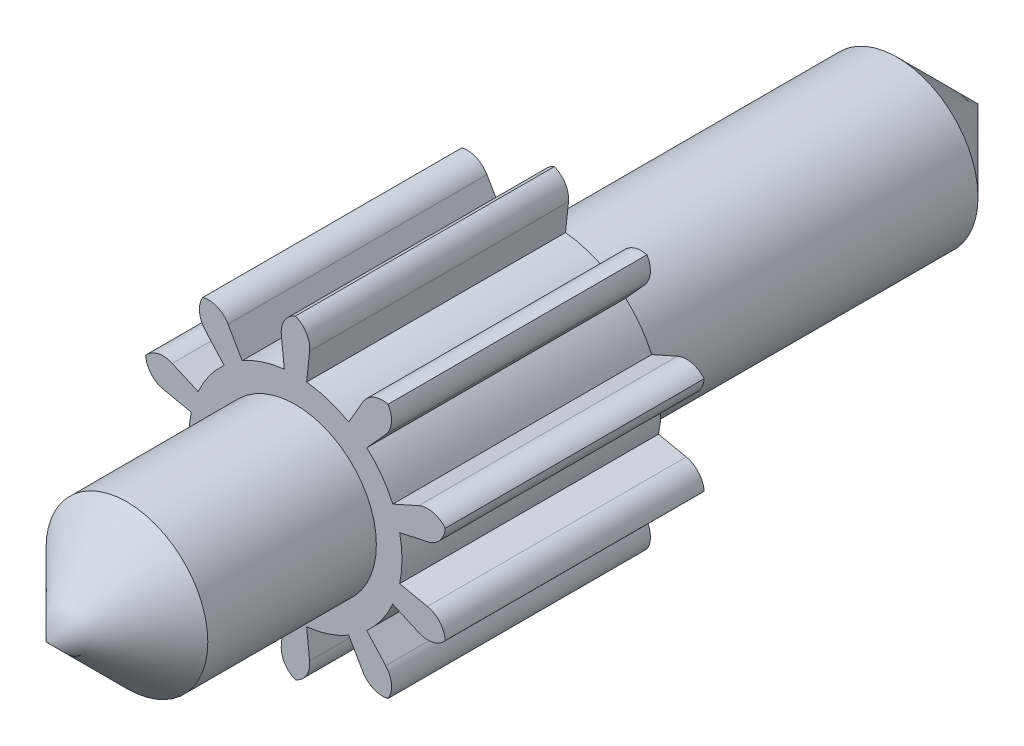
from build123d import *

# Parameters (mm, degrees)
SKETCH1_R                = 0.75
BOSS_EXTRUDE1_DEPTH      = 2.4
BOSS_EXTRUDE2_DEPTH      = 4.7124
BOSS_EXTRUDE2_DEPTH_BACK = 3.927
SKETCH1_2_R              = 0.75
CHAMFER1_SIZE            = 0.75


with BuildPart() as part:
    # Sketch1 → Boss-Extrude1 (new body)
    with BuildSketch(Plane.XY):
        with BuildLine():
            Line((-0.103544507, 0.982056406), (-0.131068996, 1.243109375))
            ThreePointArc((-0.131068996, 1.243109375), (-0.10199222, 1.373586424), (0, 1.46))
            ThreePointArc((0, 1.46), (0.10199222, 1.373586424), (0.131068996, 1.243109375))
            Line((0.131068996, 1.243109375), (0.103544507, 0.982056406))
            ThreePointArc((0.103544507, 0.982056406), (0.305154282, 0.93916831), (0.493469007, 0.855362256))
            Line((0.493469007, 0.855362256), (0.624644312, 1.082737033))
            ThreePointArc((0.624644312, 1.082737033), (0.724860403, 1.171204283), (0.858166468, 1.181164812))
            ThreePointArc((0.858166468, 1.181164812), (0.889887282, 1.051305237), (0.836718403, 0.928656187))
            Line((0.836718403, 0.928656187), (0.661007538, 0.733638388))
            ThreePointArc((0.661007538, 0.733638388), (0.798904282, 0.580437937), (0.901994132, 0.401948797))
            Line((0.901994132, 0.401948797), (1.141764724, 0.508795946))
            ThreePointArc((1.141764724, 0.508795946), (1.27484099, 0.521461914), (1.388542514, 0.451164812))
            ThreePointArc((1.388542514, 0.451164812), (1.337875649, 0.327461182), (1.222769819, 0.2594879))
            Line((1.222769819, 0.2594879), (0.965988157, 0.204995441))
            ThreePointArc((0.965988157, 0.204995441), (0.9875, 0), (0.965988157, -0.204995441))
            Line((0.965988157, -0.204995441), (1.222769819, -0.2594879))
            ThreePointArc((1.222769819, -0.2594879), (1.337875649, -0.327461182), (1.388542514, -0.451164812))
            ThreePointArc((1.388542514, -0.451164812), (1.27484099, -0.521461914), (1.141764724, -0.508795946))
            Line((1.141764724, -0.508795946), (0.901994132, -0.401948797))
            ThreePointArc((0.901994132, -0.401948797), (0.798904282, -0.580437937), (0.661007538, -0.733638388))
            Line((0.661007538, -0.733638388), (0.836718403, -0.928656187))
            ThreePointArc((0.836718403, -0.928656187), (0.889887282, -1.051305237), (0.858166468, -1.181164812))
            ThreePointArc((0.858166468, -1.181164812), (0.724860403, -1.171204283), (0.624644312, -1.082737033))
            Line((0.624644312, -1.082737033), (0.493469007, -0.855362256))
            ThreePointArc((0.493469007, -0.855362256), (0.305154282, -0.93916831), (0.103544507, -0.982056406))
            Line((0.103544507, -0.982056406), (0.131068996, -1.243109375))
            ThreePointArc((0.131068996, -1.243109375), (0.10199222, -1.373586424), (0, -1.46))
            ThreePointArc((0, -1.46), (-0.10199222, -1.373586424), (-0.131068996, -1.243109375))
            Line((-0.131068996, -1.243109375), (-0.103544507, -0.982056406))
            ThreePointArc((-0.103544507, -0.982056406), (-0.305154282, -0.93916831), (-0.493469007, -0.855362256))
            Line((-0.493469007, -0.855362256), (-0.624644312, -1.082737033))
            ThreePointArc((-0.624644312, -1.082737033), (-0.724860403, -1.171204283), (-0.858166468, -1.181164812))
            ThreePointArc((-0.858166468, -1.181164812), (-0.889887282, -1.051305237), (-0.836718403, -0.928656187))
            Line((-0.836718403, -0.928656187), (-0.661007538, -0.733638388))
            ThreePointArc((-0.661007538, -0.733638388), (-0.798904282, -0.580437937), (-0.901994132, -0.401948797))
            Line((-0.901994132, -0.401948797), (-1.141764724, -0.508795946))
            ThreePointArc((-1.141764724, -0.508795946), (-1.27484099, -0.521461914), (-1.388542514, -0.451164812))
            ThreePointArc((-1.388542514, -0.451164812), (-1.337875649, -0.327461182), (-1.222769819, -0.2594879))
            Line((-1.222769819, -0.2594879), (-0.965988157, -0.204995441))
            ThreePointArc((-0.965988157, -0.204995441), (-0.9875, 0), (-0.965988157, 0.204995441))
            Line((-0.965988157, 0.204995441), (-1.222769819, 0.2594879))
            ThreePointArc((-1.222769819, 0.2594879), (-1.337875649, 0.327461182), (-1.388542514, 0.451164812))
            ThreePointArc((-1.388542514, 0.451164812), (-1.27484099, 0.521461914), (-1.141764724, 0.508795946))
            Line((-1.141764724, 0.508795946), (-0.901994132, 0.401948797))
            ThreePointArc((-0.901994132, 0.401948797), (-0.798904282, 0.580437937), (-0.661007538, 0.733638388))
            Line((-0.661007538, 0.733638388), (-0.836718403, 0.928656187))
            ThreePointArc((-0.836718403, 0.928656187), (-0.889887282, 1.051305237), (-0.858166468, 1.181164812))
            ThreePointArc((-0.858166468, 1.181164812), (-0.724860403, 1.171204283), (-0.624644312, 1.082737033))
            Line((-0.624644312, 1.082737033), (-0.493469007, 0.855362256))
            ThreePointArc((-0.493469007, 0.855362256), (-0.305154282, 0.93916831), (-0.103544507, 0.982056406))
        make_face()
        Circle(SKETCH1_R, mode=Mode.SUBTRACT)
    extrude(amount=BOSS_EXTRUDE1_DEPTH)

    # Sketch1<2> → Boss-Extrude2 (add, two sides: drawn at the far end of the back side and taken through both)
    with BuildSketch(Plane.XY.offset(-BOSS_EXTRUDE2_DEPTH_BACK)):
        Circle(SKETCH1_2_R)
    extrude(amount=BOSS_EXTRUDE2_DEPTH + BOSS_EXTRUDE2_DEPTH_BACK)

    # Chamfer1
    chamfer1_edges = [part.edges().sort_by_distance(p)[0] for p in [
        (-0.75, 0, -3.927),
        (-0.75, 0, 4.7124),
    ]]
    chamfer(chamfer1_edges, length=CHAMFER1_SIZE)


solid = part.part
